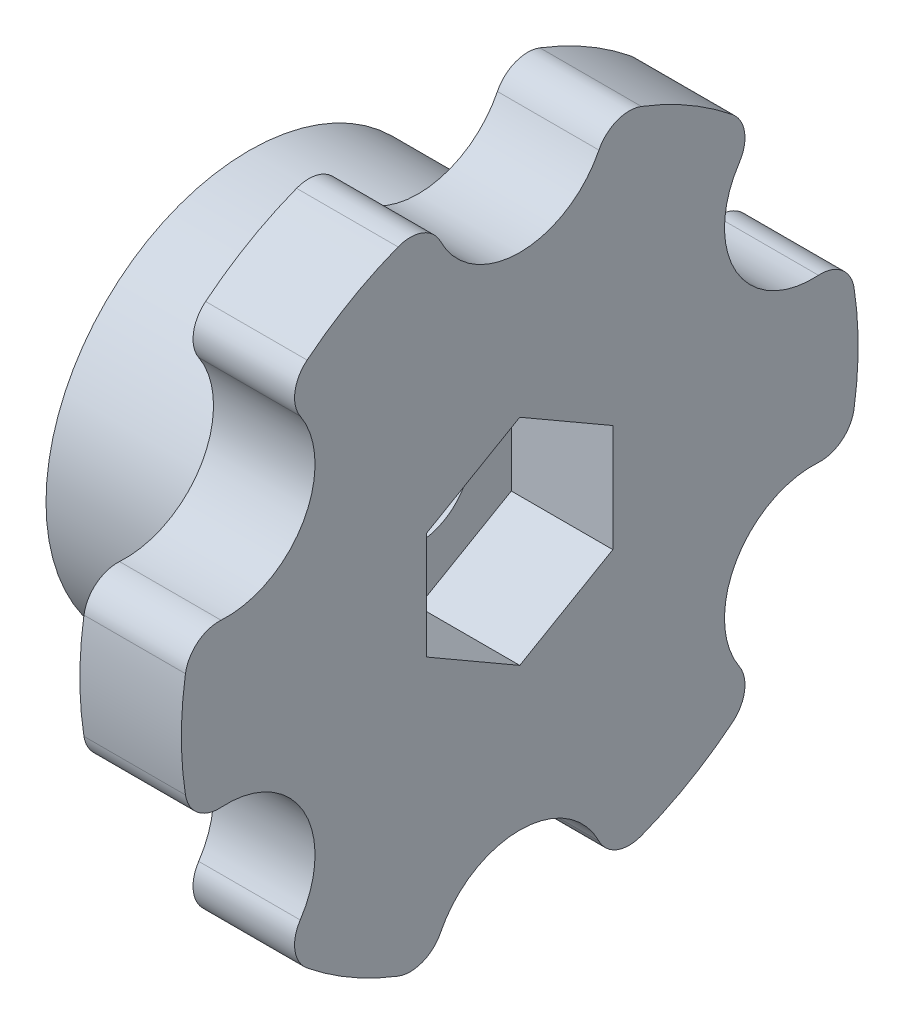
from build123d import *

# Parameters (mm, degrees)
SKETCH3_R          = 1.55
CUT_EXTRUDE1_DEPTH = 17.248076809
SKETCH4_R          = 2.610523844
CUT_EXTRUDE2_DEPTH = 17.248076809
FILLET1_R          = 1
CUT_EXTRUDE3_DEPTH = 3


with BuildPart() as part:
    # Sketch2 → Revolve1 (revolve)
    with BuildSketch(Plane.XY, mode=Mode.PRIVATE) as revolve1_sk:
        Polygon((0, 0), (8, 0), (8, 10), (5, 10), (5, 6), (0, 6), align=None)
    revolve(revolve1_sk.sketch.rotate(Axis((0, 0, 0), (1, 0, 0)), 90), axis=Axis((0, 0, 0), (1, 0, 0)))

    # Sketch3 → Cut-Extrude1 (cut, through all)
    with BuildSketch(Plane.ZY):
        Circle(SKETCH3_R)
    extrude(amount=-CUT_EXTRUDE1_DEPTH, mode=Mode.SUBTRACT)

    # Sketch4 → Cut-Extrude2 (cut, through all)
    with BuildSketch(Plane(origin=(8, 0, 0), x_dir=(0, 0, -1), z_dir=(1, 0, 0))):
        with Locations((0, 10)):
            Circle(SKETCH4_R)
        with Locations((8.660254038, 5)):
            Circle(SKETCH4_R)
        with Locations((8.660254038, -5)):
            Circle(SKETCH4_R)
        with Locations((0, -10)):
            Circle(SKETCH4_R)
        with Locations((-8.660254038, -5)):
            Circle(SKETCH4_R)
        with Locations((-8.660254038, 5)):
            Circle(SKETCH4_R)
    extrude(amount=-CUT_EXTRUDE2_DEPTH, mode=Mode.SUBTRACT)

    # Fillet1
    fillet1_edges = [part.edges().sort_by_distance(p)[0] for p in [
        (6.5, 2.588190451, -9.659258263),
        (6.5, 7.071067812, -7.071067812),
        (6.5, -7.071067812, -7.071067812),
        (6.5, -2.588190451, -9.659258263),
        (6.5, -9.659258263, 2.588190451),
        (6.5, -9.659258263, -2.588190451),
        (6.5, -2.588190451, 9.659258263),
        (6.5, -7.071067812, 7.071067812),
        (6.5, 7.071067812, 7.071067812),
        (6.5, 2.588190451, 9.659258263),
        (6.5, 9.659258263, -2.588190451),
        (6.5, 9.659258263, 2.588190451),
    ]]
    fillet(fillet1_edges, radius=FILLET1_R)

    # Sketch5 → Cut-Extrude3 (cut)
    with BuildSketch(Plane(origin=(8, 0, 0), x_dir=(0, 0, -1), z_dir=(1, 0, 0))):
        Polygon((2.749630657, 1.5875), (0, 3.175), (-2.749630657, 1.5875), (-2.749630657, -1.5875), (0, -3.175), (2.749630657, -1.5875), align=None)
    extrude(amount=-CUT_EXTRUDE3_DEPTH, mode=Mode.SUBTRACT)


solid = part.part
